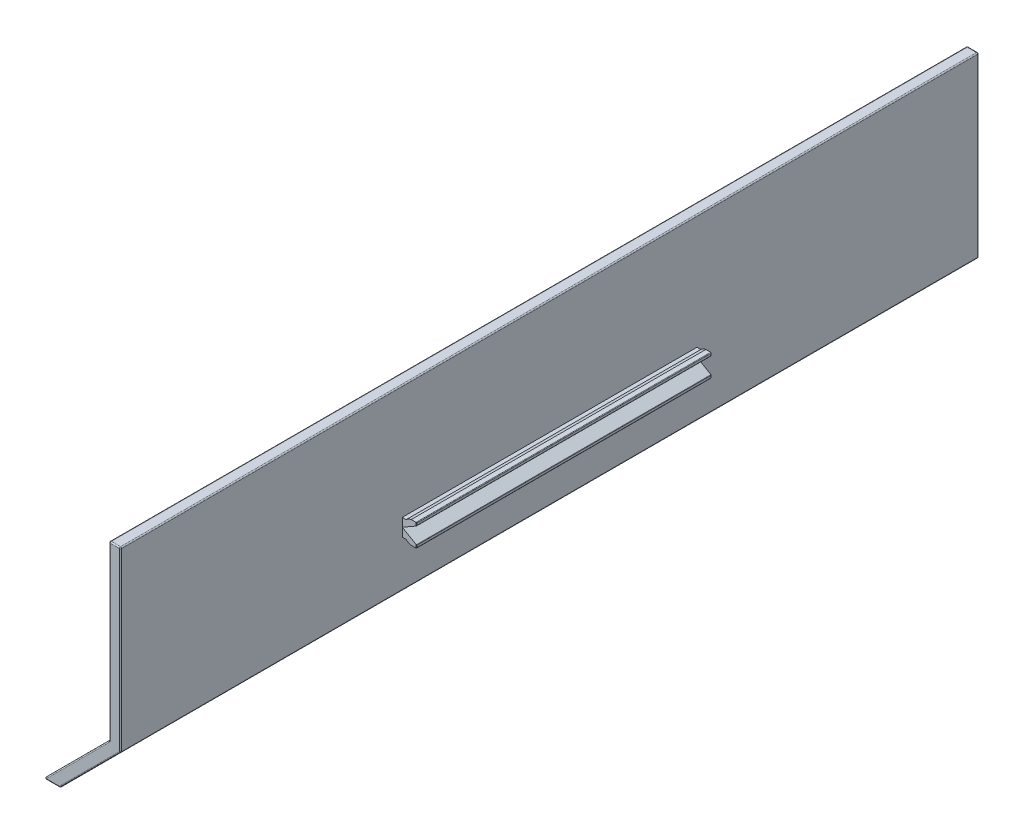
from build123d import *

# Parameters (mm, degrees)
EXTRUDE_1_DEPTH = 150
EXTRUDE_START   = -49.25
EXTRUDE_2_DEPTH = 51.5
FILLET_1_R      = 0.1
FILLET_2_R      = 0.2


with BuildPart() as part:
    # 草图1 → 凸台-拉伸1 (new body)
    with BuildSketch(Plane.XY):
        Polygon((0, 0), (0, 31), (-2, 31), (-2, 0.828427125), (-13.435028843, -10.606601718), (-10.606601718, -10.606601718), align=None)
    extrude(amount=EXTRUDE_1_DEPTH)

    # 草图3 → 凸台-拉伸2 (add)
    with BuildSketch(Plane.XY.offset(150).offset(EXTRUDE_START)):
        with BuildLine():
            Line((0, 9.5), (0, 8))
            Line((0, 8), (0.677124344, 8))
            ThreePointArc((0.677124344, 8), (1.088161527, 7.719957697), (1.555590279, 7.55))
            Line((1.555590279, 7.55), (2.5, 7.55))
            Line((2.5, 7.55), (2.5, 8.056624327))
            Line((2.5, 8.056624327), (0, 9.5))
        make_face()
    extrude_2 = extrude(amount=-EXTRUDE_2_DEPTH)

    # 镜向1: 凸台-拉伸2 across plane
    add(extrude_2.mirror(Plane.ZX.offset(9.5)))

    # 圆角1
    fillet_1_edges = [part.edges().sort_by_distance(p)[0] for p in [
        (2.5, 7.803312164, 49.25),
        (2.5, 8.056624327, 75),
        (2.5, 7.55, 75),
        (2.5, 7.803312164, 100.75),
        (2.5, 10.943375673, 75),
        (2.5, 11.196687836, 100.75),
        (2.5, 11.45, 75),
        (2.5, 11.196687836, 49.25),
    ]]
    fillet(fillet_1_edges, radius=FILLET_1_R)

    # 圆角2
    fillet_2_edges = [part.edges().sort_by_distance(p)[0] for p in [
        (-1, 31, 150),
        (-10.606601718, -10.606601718, 75),
        (-13.435028843, -10.606601718, 75),
        (-2, 0.828427125, 75),
        (-2, 31, 75),
        (0, 31, 75),
        (0, 0, 75),
        (-2, 15.914213562, 150),
        (-7.717514421, -4.889087297, 150),
        (-12.02081528, -10.606601718, 150),
        (-5.303300859, -5.303300859, 150),
        (-12.02081528, -10.606601718, 0),
        (-7.717514421, -4.889087297, 0),
        (-2, 15.914213562, 0),
        (0, 15.5, 150),
        (-1, 31, 0),
        (0, 15.5, 0),
        (-5.303300859, -5.303300859, 0),
    ]]
    fillet(fillet_2_edges, radius=FILLET_2_R)


solid = part.part
